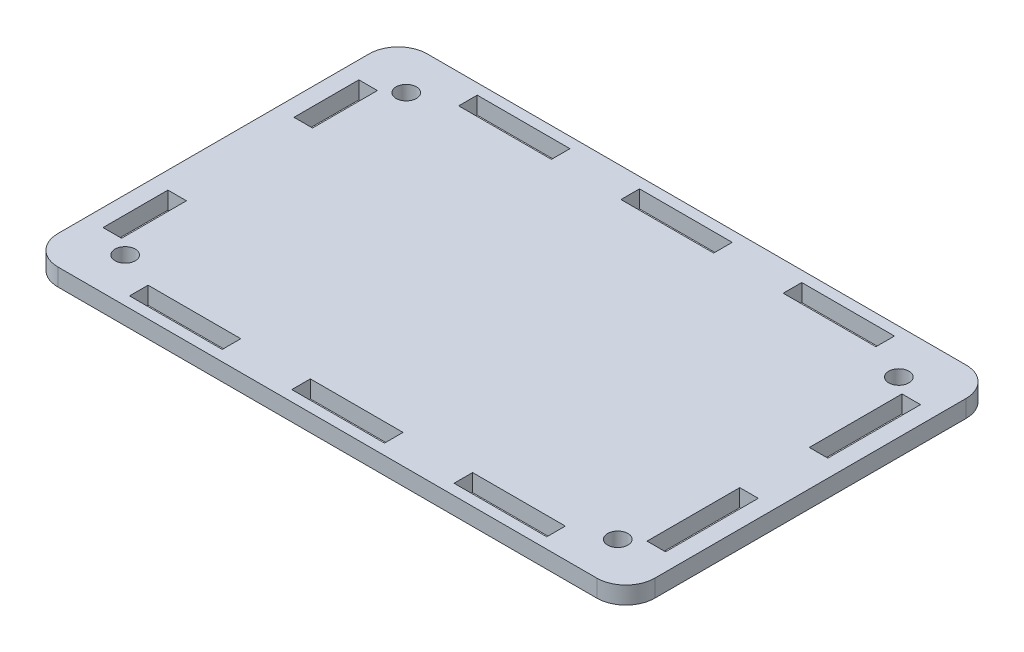
from build123d import *

# Parameters (mm, degrees)
SKETCH1_W           = 103
SKETCH1_H           = 63.711340206
SKETCH1_R           = 1.75
SKETCH1_W_2         = 16
SKETCH1_H_2         = 3.2
SKETCH1_W_3         = 3.2
SKETCH1_H_3         = 11.2
SKETCH1_H_4         = 16
BOSS_EXTRUDE1_DEPTH = 3
FILLET1_R           = 5


with BuildPart() as part:
    # Sketch1 → Boss-Extrude1 (new body)
    with BuildSketch(Plane(origin=(0, 0, 0), x_dir=(1, 0, 0), z_dir=(0, 1, 0))):
        Rectangle(SKETCH1_W, SKETCH1_H)
        with Locations(Location((-42.5, 24.25, 0), (0, 0, 270))):
            Circle(SKETCH1_R, mode=Mode.SUBTRACT)
        with Locations(Location((42.5, 24.25, 0), (0, 0, 270))):
            Circle(SKETCH1_R, mode=Mode.SUBTRACT)
        with Locations(Location((-42.5, -24.25, 0), (0, 0, 270))):
            Circle(SKETCH1_R, mode=Mode.SUBTRACT)
        with Locations(Location((42.5, -24.25, 0), (0, 0, 270))):
            Circle(SKETCH1_R, mode=Mode.SUBTRACT)
        with Locations((-28, 28.4)):
            Rectangle(SKETCH1_W_2, SKETCH1_H_2, mode=Mode.SUBTRACT)
        with Locations((28, 28.4)):
            Rectangle(SKETCH1_W_2, SKETCH1_H_2, mode=Mode.SUBTRACT)
        with Locations((-46.9, 16.475)):
            Rectangle(SKETCH1_W_3, SKETCH1_H_3, mode=Mode.SUBTRACT)
        with Locations((-46.9, -16.475)):
            Rectangle(SKETCH1_W_3, SKETCH1_H_3, mode=Mode.SUBTRACT)
        with Locations((0, 28.4)):
            Rectangle(SKETCH1_W_2, SKETCH1_H_2, mode=Mode.SUBTRACT)
        with Locations((-28, -28.4)):
            Rectangle(SKETCH1_W_2, SKETCH1_H_2, mode=Mode.SUBTRACT)
        with Locations((28, -28.4)):
            Rectangle(SKETCH1_W_2, SKETCH1_H_2, mode=Mode.SUBTRACT)
        with Locations((0, -28.4)):
            Rectangle(SKETCH1_W_2, SKETCH1_H_2, mode=Mode.SUBTRACT)
        with Locations((46.9, -14)):
            Rectangle(SKETCH1_W_3, SKETCH1_H_4, mode=Mode.SUBTRACT)
        with Locations((46.9, 14)):
            Rectangle(SKETCH1_W_3, SKETCH1_H_4, mode=Mode.SUBTRACT)
    extrude(amount=BOSS_EXTRUDE1_DEPTH)

    # Fillet1
    fillet1_edges = [part.edges().sort_by_distance(p)[0] for p in [
        (51.5, 1.5, 31.855670103),
        (-51.5, 1.5, 31.855670103),
        (-51.5, 1.5, -31.855670103),
        (51.5, 1.5, -31.855670103),
    ]]
    fillet(fillet1_edges, radius=FILLET1_R)


solid = part.part
